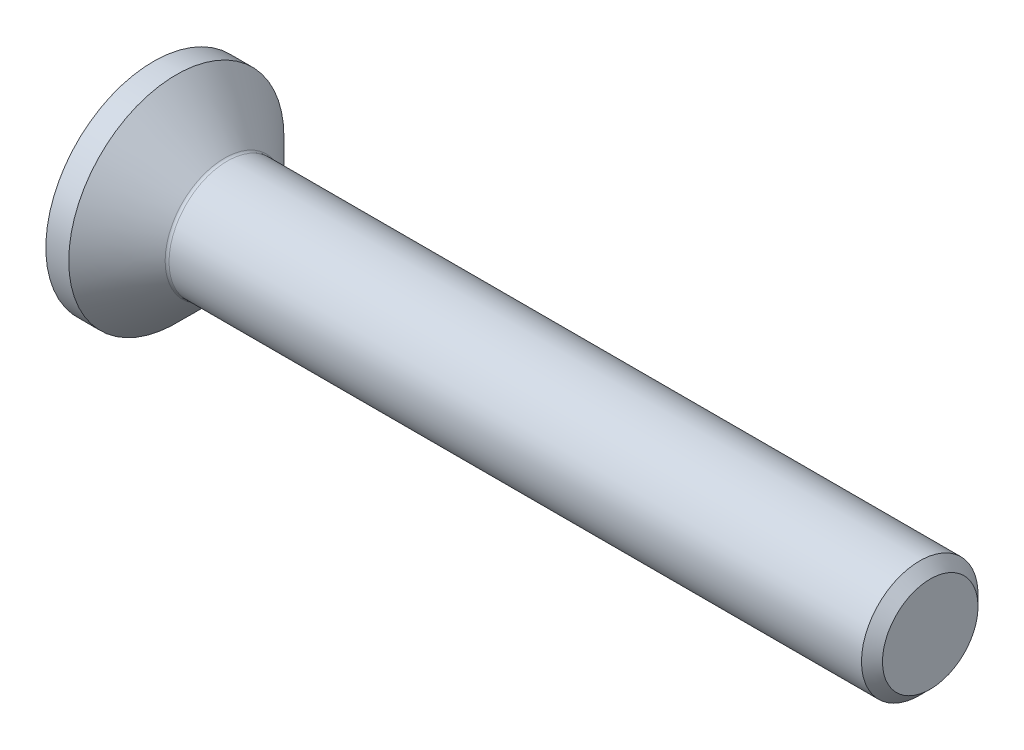
from build123d import *

# Parameters (mm, degrees)
HEXAGONSOCKET_DEPTH = 1.1
HEADFILLET_R        = 0.1
CHAMFER_2_SIZE      = 0.2705
SKETCH4_W           = 5
SKETCH4_H           = 5


with BuildPart() as part:
    # Sketch1 → Base (revolve)
    with BuildSketch(Plane.XY, mode=Mode.PRIVATE) as base_sk:
        Polygon((0, 0), (0, 3.36), (1.86, 1.5), (20, 1.5), (20, 0), align=None)
    revolve(base_sk.sketch.rotate(Axis((-0.587069181, 0, 0), (1, 0, 0)), 90), axis=Axis((-0.587069181, 0, 0), (1, 0, 0)))

    # Sketch2 → HexagonSocket (cut)
    with BuildSketch(Plane(origin=(0, 0, 0), x_dir=(0, 0, -1), z_dir=(1, 0, 0))):
        Polygon((1.154700538, 0), (0.577350269, 1), (-0.577350269, 1), (-1.154700538, 0), (-0.577350269, -1), (0.577350269, -1), align=None)
    extrude(amount=HEXAGONSOCKET_DEPTH, mode=Mode.SUBTRACT)

    # Sketch3 → Cut-Revolve1 (revolve, cut)
    with BuildSketch(Plane.XY, mode=Mode.PRIVATE) as cut_revolve1_sk:
        Polygon((1.1, 1), (1.677350269, 0), (1.1, 0), align=None)
    revolve(cut_revolve1_sk.sketch.rotate(Axis((-0.439109555, 0, 0), (1, 0, 0)), 90), axis=Axis((-0.439109555, 0, 0), (1, 0, 0)), mode=Mode.SUBTRACT)

    # HeadFillet
    headfillet_edges = [part.edges().sort_by_distance(p)[0] for p in [
        (1.86, 0, -1.5),
    ]]
    fillet(headfillet_edges, radius=HEADFILLET_R)

    # Chamfer 2
    chamfer_2_edges = [part.edges().sort_by_distance(p)[0] for p in [
        (20, 0, -1.5),
    ]]
    chamfer(chamfer_2_edges, length=CHAMFER_2_SIZE)

    # Sketch4 → Cut-Revolve2 (revolve, cut)
    with BuildSketch(Plane(origin=(0, 0, 0), x_dir=(1, 0, 0), z_dir=(0, 1, 0)), mode=Mode.PRIVATE) as cut_revolve2_sk:
        with Locations((0.5, 5.27)):
            Rectangle(SKETCH4_W, SKETCH4_H)
    revolve(cut_revolve2_sk.sketch.rotate(Axis((11.853138686, 0, 0), (-1, 0, 0)), 180), axis=Axis((11.853138686, 0, 0), (-1, 0, 0)), mode=Mode.SUBTRACT)


solid = part.part
